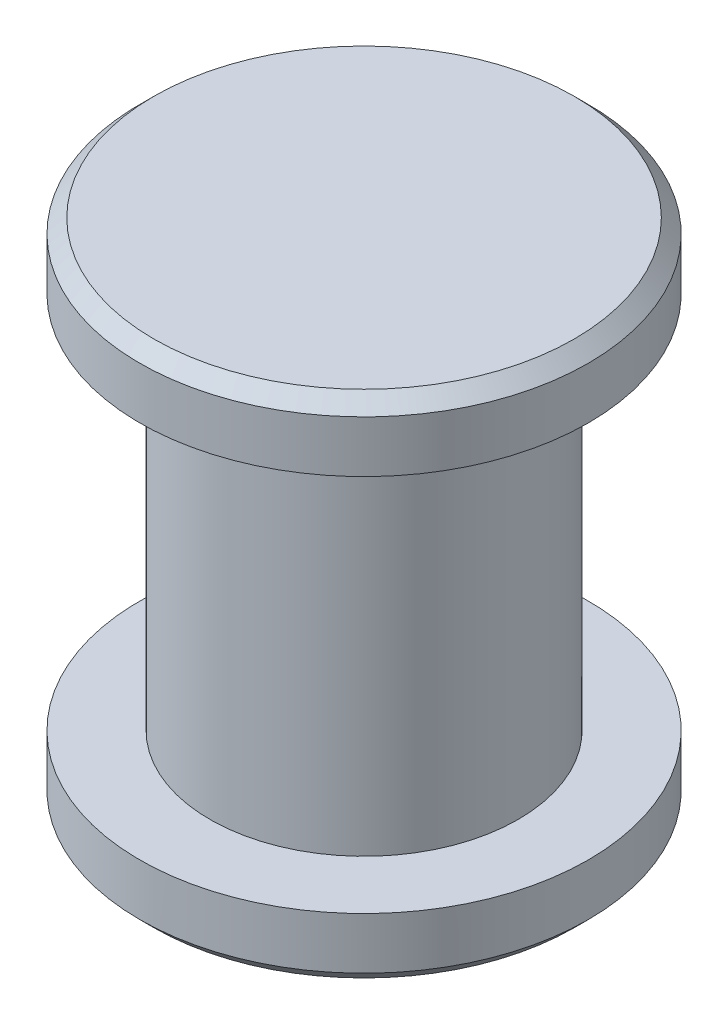
from build123d import *

# Parameters (mm, degrees)
CHAMFER1_SIZE = 0.25


with BuildPart() as part:
    # Sketch1 → Revolve1 (revolve)
    with BuildSketch(Plane.XY, mode=Mode.PRIVATE) as revolve1_sk:
        Polygon((0, 9.09486067), (-4, 9.09486067), (-4, 7.922430335), (-2.75, 7.922430335), (-2.75, 1.172430335), (-4, 1.172430335), (-4, 0), (0, 0), align=None)
    revolve(revolve1_sk.sketch.rotate(Axis((0, 0, 0), (0, 1, 0)), 180), axis=Axis((0, 0, 0), (0, 1, 0)))

    # Chamfer1
    chamfer1_edges = [part.edges().sort_by_distance(p)[0] for p in [
        (-4, 0, 0),
        (-4, 9.09486067, 0),
    ]]
    chamfer(chamfer1_edges, length=CHAMFER1_SIZE)


solid = part.part
